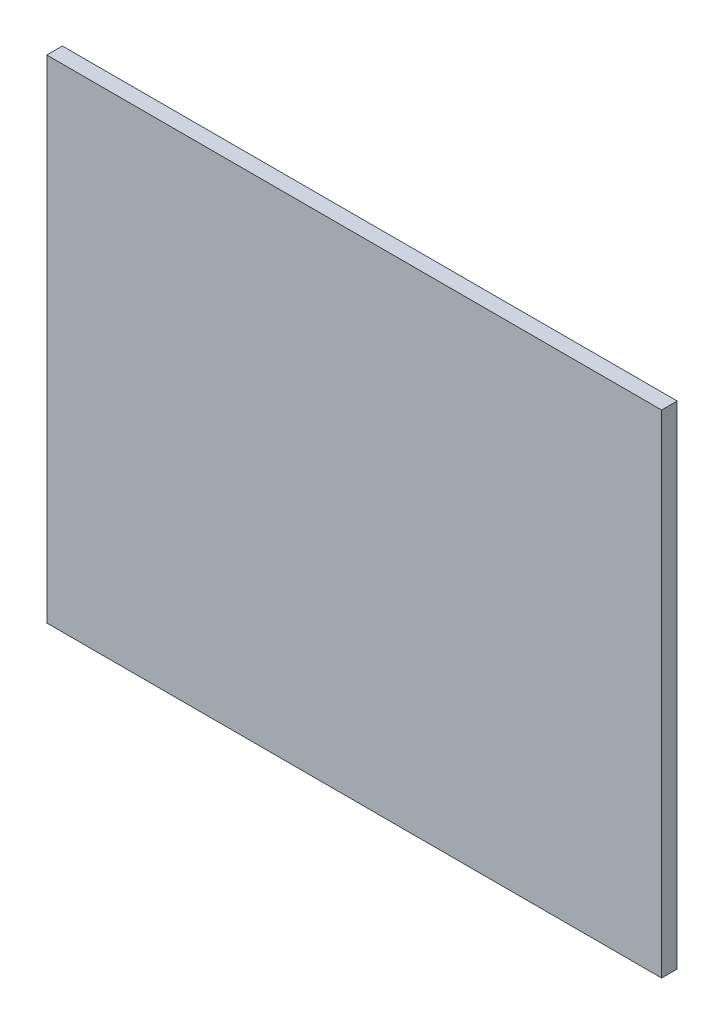
from build123d import *

# Parameters (mm, degrees)
SKETCH1_W           = 500
SKETCH1_H           = 400
BOSS_EXTRUDE1_DEPTH = 12.7


with BuildPart() as part:
    # Sketch1 → Boss-Extrude1 (new body)
    with BuildSketch(Plane.XY):
        with Locations((-51.794362674, -45.15896198)):
            Rectangle(SKETCH1_W, SKETCH1_H)
    extrude(amount=BOSS_EXTRUDE1_DEPTH)


solid = part.part
